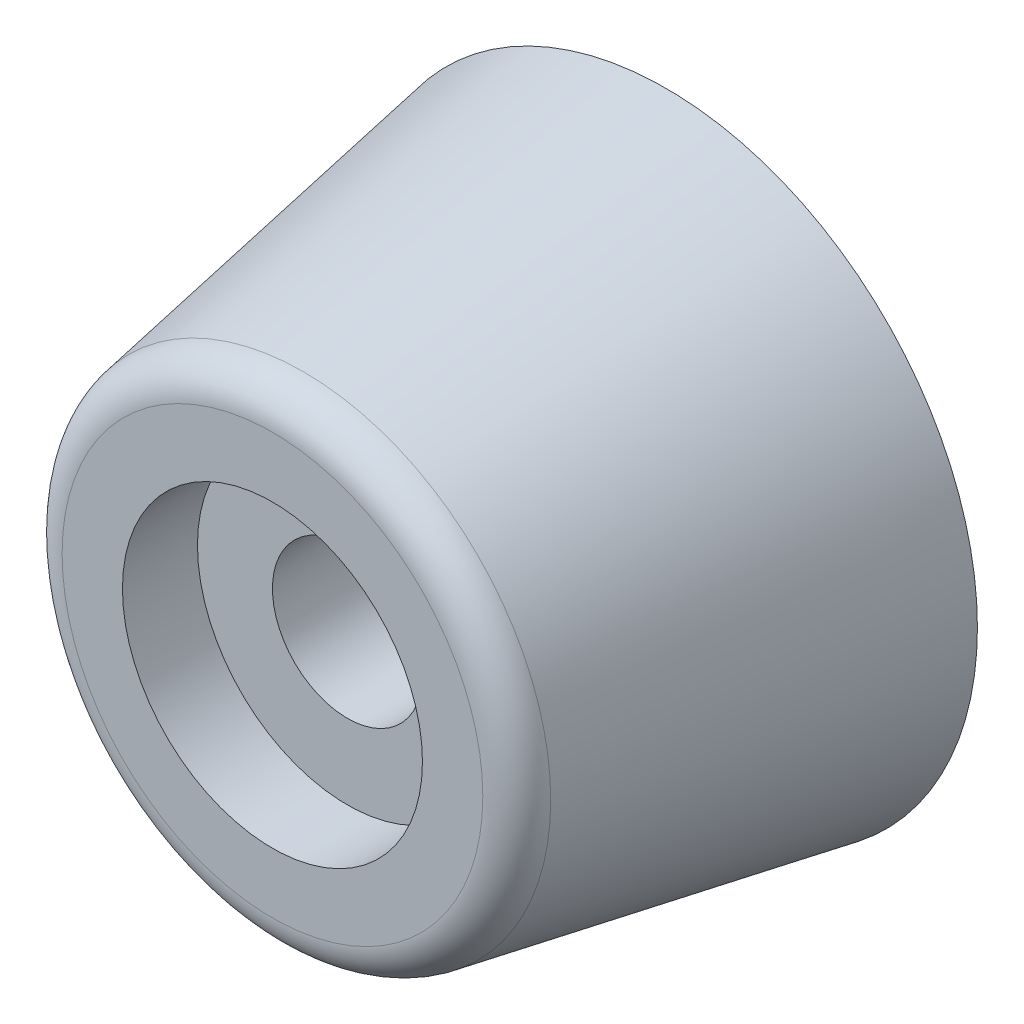
from build123d import *

# Parameters (mm, degrees)
ESQUISSE1_R             = 8.3
BOSS_EXTRU_1_DEPTH      = 10.5
BOSS_EXTRU_1_TAPER      = 10
ESQUISSE2_R             = 4
ENL_V_MAT_EXTRU_1_DEPTH = 2
ESQUISSE3_R             = 2
ENL_V_MAT_EXTRU_2_DEPTH = 14
CONG_1_R                = 1


with BuildPart() as part:
    # Esquisse1 → Boss.-Extru.1 (new body)
    with BuildSketch(Plane.XY):
        Circle(ESQUISSE1_R)
    extrude(amount=BOSS_EXTRU_1_DEPTH, taper=BOSS_EXTRU_1_TAPER)

    # Esquisse2 → Enlèv. mat.-Extru.1 (cut)
    with BuildSketch(Plane.XY.offset(10.5)):
        Circle(ESQUISSE2_R)
    extrude(amount=-ENL_V_MAT_EXTRU_1_DEPTH, mode=Mode.SUBTRACT)

    # Esquisse3 → Enlèv. mat.-Extru.2 (cut)
    with BuildSketch(Plane.XY.offset(8.5)):
        Circle(ESQUISSE3_R)
    extrude(amount=-ENL_V_MAT_EXTRU_2_DEPTH, mode=Mode.SUBTRACT)

    # Congé1
    cong_1_edges = [part.edges().sort_by_distance(p)[0] for p in [
        (-6.448566703, 0, 10.5),
    ]]
    fillet(cong_1_edges, radius=CONG_1_R)


solid = part.part
